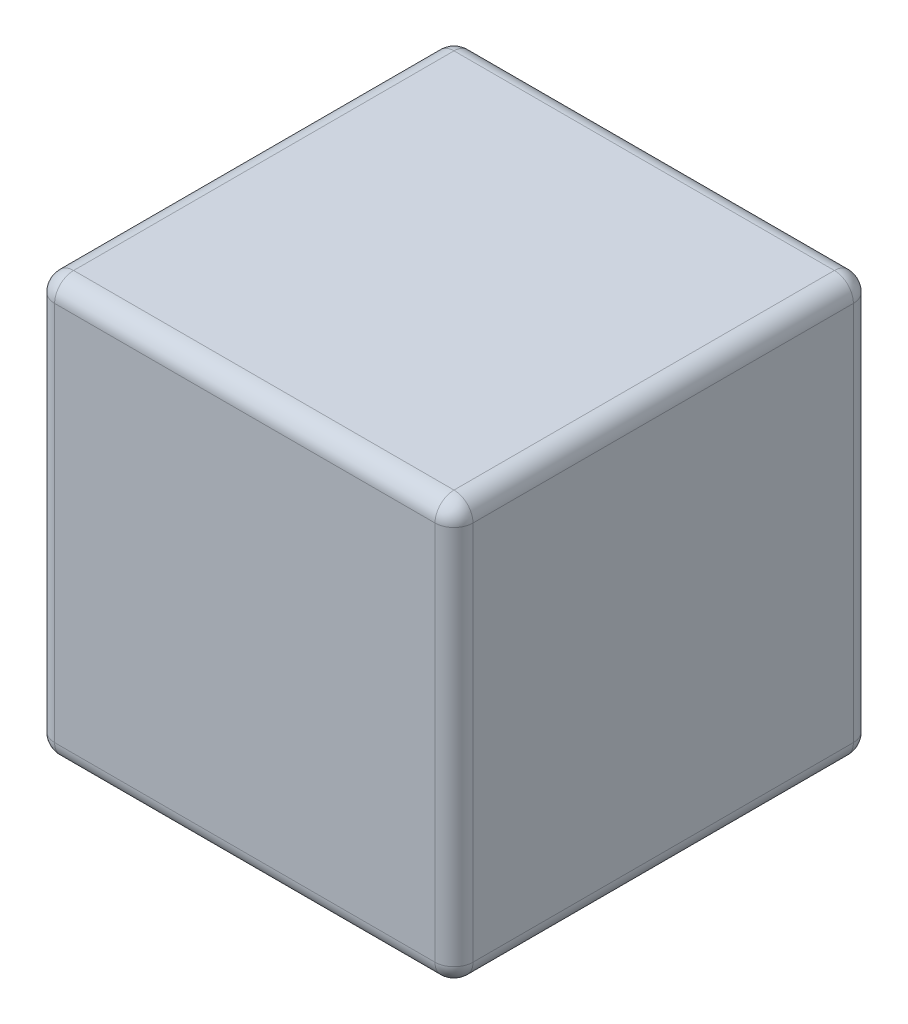
from build123d import *

# Parameters (mm, degrees)
BOSS_EXTRUDE1_DEPTH      = 27.5
BOSS_EXTRUDE1_DEPTH_BACK = 27.5
SKETCH1_W                = 55
SKETCH1_H                = 55
FILLET1_R                = 2.5


with BuildPart() as part:
    # Sketch1 → Boss-Extrude1 (new, two sides: drawn at the far end of the back side and taken through both)
    with BuildSketch(Plane(origin=(0, 0, 0), x_dir=(1, 0, 0), z_dir=(0, 1, 0)).offset(-BOSS_EXTRUDE1_DEPTH_BACK)):
        Rectangle(SKETCH1_W, SKETCH1_H)
    extrude(amount=BOSS_EXTRUDE1_DEPTH + BOSS_EXTRUDE1_DEPTH_BACK)

    # Fillet1
    fillet1_edges = [part.edges().sort_by_distance(p)[0] for p in [
        (-27.5, -27.5, 0),
        (-27.5, 27.5, 0),
        (0, -27.5, -27.5),
        (0, 27.5, -27.5),
        (-27.5, 0, -27.5),
        (27.5, -27.5, 0),
        (27.5, 27.5, 0),
        (27.5, 0, -27.5),
        (0, -27.5, 27.5),
        (-27.5, 0, 27.5),
        (0, 27.5, 27.5),
        (27.5, 0, 27.5),
    ]]
    fillet(fillet1_edges, radius=FILLET1_R)


solid = part.part
